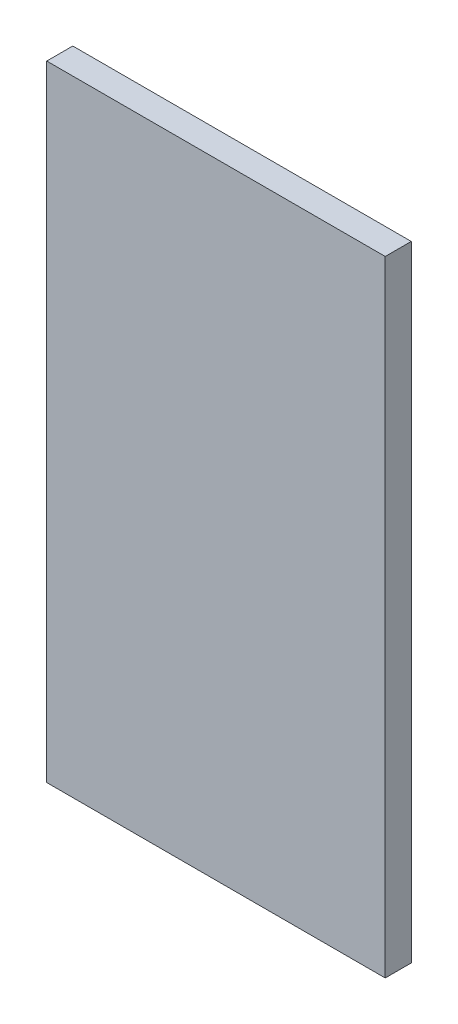
from build123d import *

# Parameters (mm, degrees)
SKETCH1_W           = 82.55
SKETCH1_H           = 6.35
BOSS_EXTRUDE1_DEPTH = 152.4


with BuildPart() as part:
    # Sketch1 → Boss-Extrude1 (new body)
    with BuildSketch(Plane(origin=(0, 0, 0), x_dir=(1, 0, 0), z_dir=(0, 1, 0))):
        with Locations((-7.093085106, 27.426595745)):
            Rectangle(SKETCH1_W, SKETCH1_H)
    extrude(amount=BOSS_EXTRUDE1_DEPTH)


solid = part.part
